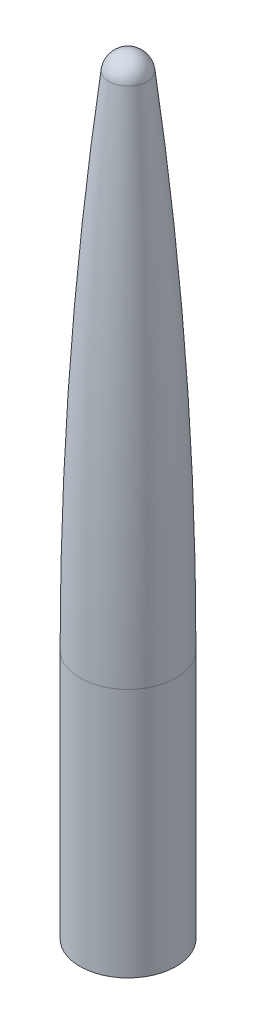
from build123d import *


with BuildPart() as part:
    # Sketch2 → Revolve1 (revolve)
    with BuildSketch(Plane.XY, mode=Mode.PRIVATE) as revolve1_sk:
        with BuildLine():
            Line((0, 0), (2.5, 0))
            Line((2.5, 0), (2.5, 13))
            ThreePointArc((2.5, 13), (2.123028422, 26.079213178), (0.993365278, 39.115001843))
            ThreePointArc((0.993365278, 39.115001843), (0.665206042, 39.746659843), (0, 40))
            Line((0, 40), (0, 0))
        make_face()
    revolve(revolve1_sk.sketch.rotate(Axis((0, 0, 0), (0, 1, 0)), 90), axis=Axis((0, 0, 0), (0, 1, 0)))


solid = part.part
